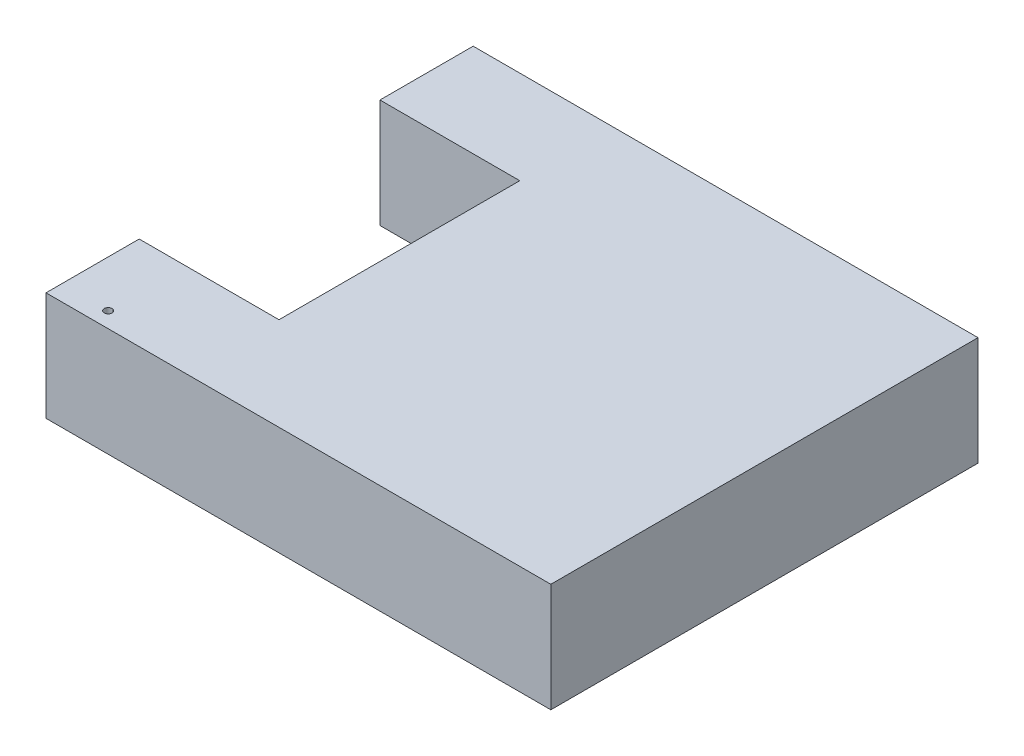
from build123d import *

# Parameters (mm, degrees)
BOSS_EXTRUDE1_DEPTH = 177.8
SKETCH3_R           = 6.35
CUT_EXTRUDE1_DEPTH  = 1096.885641844


with BuildPart() as part:
    # Sketch2 → Boss-Extrude1 (new body)
    with BuildSketch(Plane(origin=(0, 0, 0), x_dir=(1, 0, 0), z_dir=(0, 1, 0))):
        Polygon((0, 546.1), (0, 698.5), (825.5, 698.5), (825.5, 0), (0, 0), (0, 152.4), (228.6, 152.4), (228.6, 546.1), align=None)
    extrude(amount=BOSS_EXTRUDE1_DEPTH)

    # Sketch3 → Cut-Extrude1 (cut, through all)
    with BuildSketch(Plane(origin=(0, 0, 0), x_dir=(-1, 0, 0), z_dir=(0, -1, 0))):
        with Locations(Location((-76.2, 25.4, 0), (0, 0, 90))):
            Circle(SKETCH3_R)
    extrude(amount=-CUT_EXTRUDE1_DEPTH, mode=Mode.SUBTRACT)


solid = part.part
